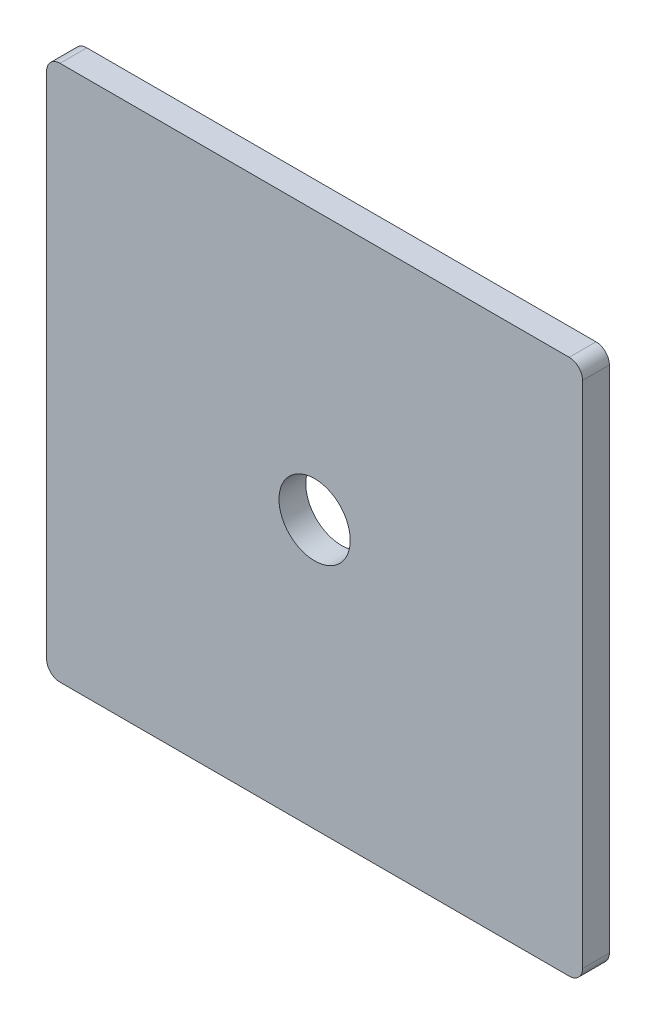
from build123d import *

# Parameters (mm, degrees)
EXTRUDE_1_DEPTH     = 0.3
SKETCH_2_R          = 0.398831964
CUT_EXTRUDE_1_DEPTH = 10


with BuildPart() as part:
    # 草图1 → 凸台-拉伸1 (new body)
    with BuildSketch(Plane(origin=(0, 0, 3.15), x_dir=(-1, 0, 0), z_dir=(0, 0, -1))):
        with BuildLine():
            Line((-2.85, -3), (2.85, -3))
            ThreePointArc((2.85, -3), (2.956066017, -2.956066017), (3, -2.85))
            Line((3, -2.85), (3, 2.85))
            ThreePointArc((3, 2.85), (2.956066017, 2.956066017), (2.85, 3))
            Line((2.85, 3), (-2.85, 3))
            ThreePointArc((-2.85, 3), (-2.956066017, 2.956066017), (-3, 2.85))
            Line((-3, 2.85), (-3, -2.85))
            ThreePointArc((-3, -2.85), (-2.956066017, -2.956066017), (-2.85, -3))
        make_face()
    extrude(amount=-EXTRUDE_1_DEPTH)

    # 草图2 → 切除-拉伸1 (cut)
    with BuildSketch(Plane.XY.offset(3.45)):
        Circle(SKETCH_2_R)
    extrude(amount=-CUT_EXTRUDE_1_DEPTH, mode=Mode.SUBTRACT)


solid = part.part
